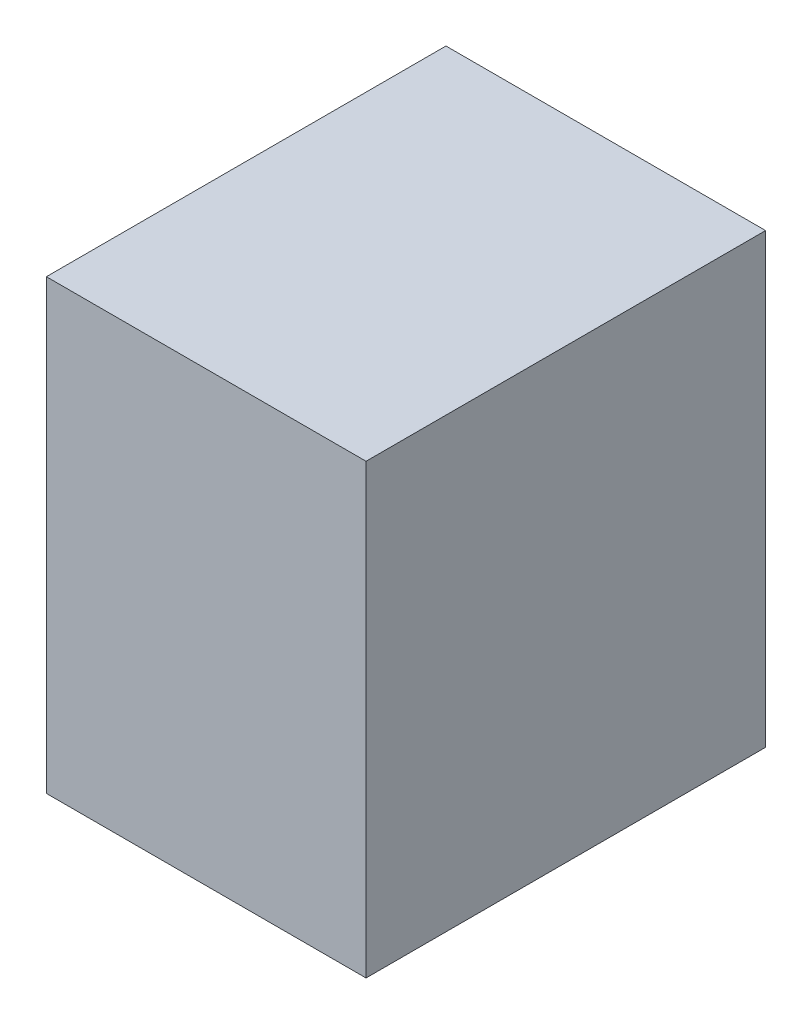
from build123d import *

# Parameters (mm, degrees)
SKETCH_1_W      = 200
SKETCH_1_H      = 250
EXTRUDE_1_DEPTH = 280


with BuildPart() as part:
    # Эскиз1 → Бобышка-Вытянуть1 (new body)
    with BuildSketch(Plane(origin=(0, 0, 0), x_dir=(1, 0, 0), z_dir=(0, 1, 0))):
        with Locations((100, 125)):
            Rectangle(SKETCH_1_W, SKETCH_1_H)
    extrude(amount=EXTRUDE_1_DEPTH)


solid = part.part
